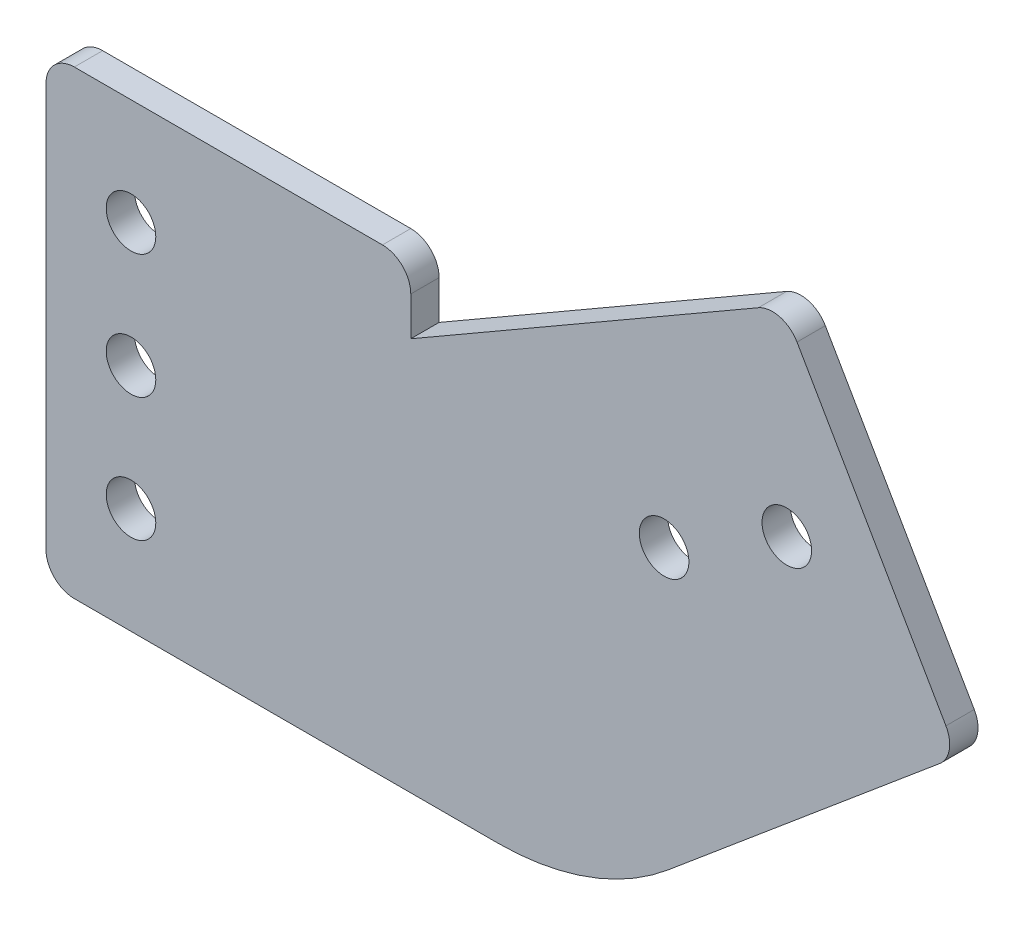
from build123d import *

# Parameters (mm, degrees)
SKETCH1_R           = 1.75
BOSS_EXTRUDE1_DEPTH = 2


with BuildPart() as part:
    # Sketch1 → Boss-Extrude1 (new body)
    with BuildSketch(Plane.XY):
        with BuildLine():
            Line((24.25, 33), (2.5, 33))
            ThreePointArc((2.5, 33), (1.085786438, 32.414213562), (0.5, 31))
            Line((0.5, 31), (0.5, 2.5))
            ThreePointArc((0.5, 2.5), (1.085786438, 1.085786438), (2.5, 0.5))
            Line((2.5, 0.5), (32.377282652, 0.5))
            ThreePointArc((32.377282652, 0.5), (38.790160339, 1.63076336), (44.429550333, 4.886666692))
            Line((44.429550333, 4.886666692), (63.578598927, 20.954626304))
            ThreePointArc((63.578598927, 20.954626304), (64.262639213, 22.139418835), (64.025074515, 23.48671519))
            Line((64.025074515, 23.48671519), (53.513611416, 41.69310334))
            ThreePointArc((53.513611416, 41.69310334), (52.299198698, 42.624954992), (50.781560608, 42.425154147))
            Line((50.781560608, 42.425154147), (26.25, 28.261851027))
            Line((26.25, 28.261851027), (26.25, 31))
            ThreePointArc((26.25, 31), (25.664213562, 32.414213562), (24.25, 33))
        make_face()
        with Locations((52.79293994, 29.441342951)):
            Circle(SKETCH1_R, mode=Mode.SUBTRACT)
        with Locations((44.132685902, 24.441342951)):
            Circle(SKETCH1_R, mode=Mode.SUBTRACT)
        with Locations((6.5, 25.5)):
            Circle(SKETCH1_R, mode=Mode.SUBTRACT)
        with Locations((6.5, 16.75)):
            Circle(SKETCH1_R, mode=Mode.SUBTRACT)
        with Locations((6.5, 8)):
            Circle(SKETCH1_R, mode=Mode.SUBTRACT)
    extrude(amount=BOSS_EXTRUDE1_DEPTH)


solid = part.part
